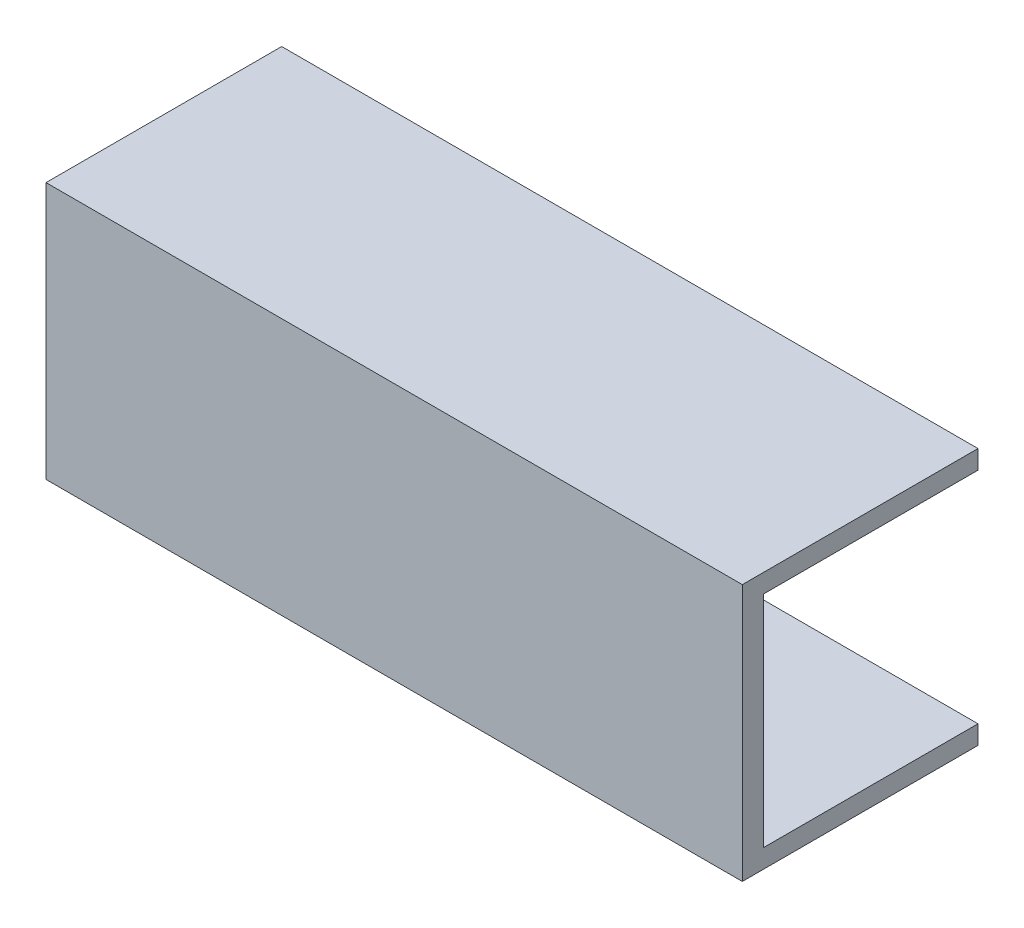
from build123d import *

# Parameters (mm, degrees)
SKETCH_1_W          = 65
SKETCH_1_H          = 22
EXTRUDE_1_DEPTH     = 24
SKETCH_2_W          = 20
SKETCH_2_H          = 20.5
CUT_EXTRUDE_1_DEPTH = 72.01950498


with BuildPart() as part:
    # 草图1 → 凸台-拉伸1 (new body)
    with BuildSketch(Plane(origin=(0, 0, 0), x_dir=(1, 0, 0), z_dir=(0, 1, 0))):
        with Locations((-1.756756757, 4.581081081)):
            Rectangle(SKETCH_1_W, SKETCH_1_H)
    extrude(amount=EXTRUDE_1_DEPTH)

    # 草图2 → 切除-拉伸1 (cut, through all)
    with BuildSketch(Plane.ZY.offset(34.256756757)):
        with Locations((-5.581081081, 12)):
            Rectangle(SKETCH_2_W, SKETCH_2_H)
    extrude(amount=-CUT_EXTRUDE_1_DEPTH, mode=Mode.SUBTRACT)


solid = part.part
